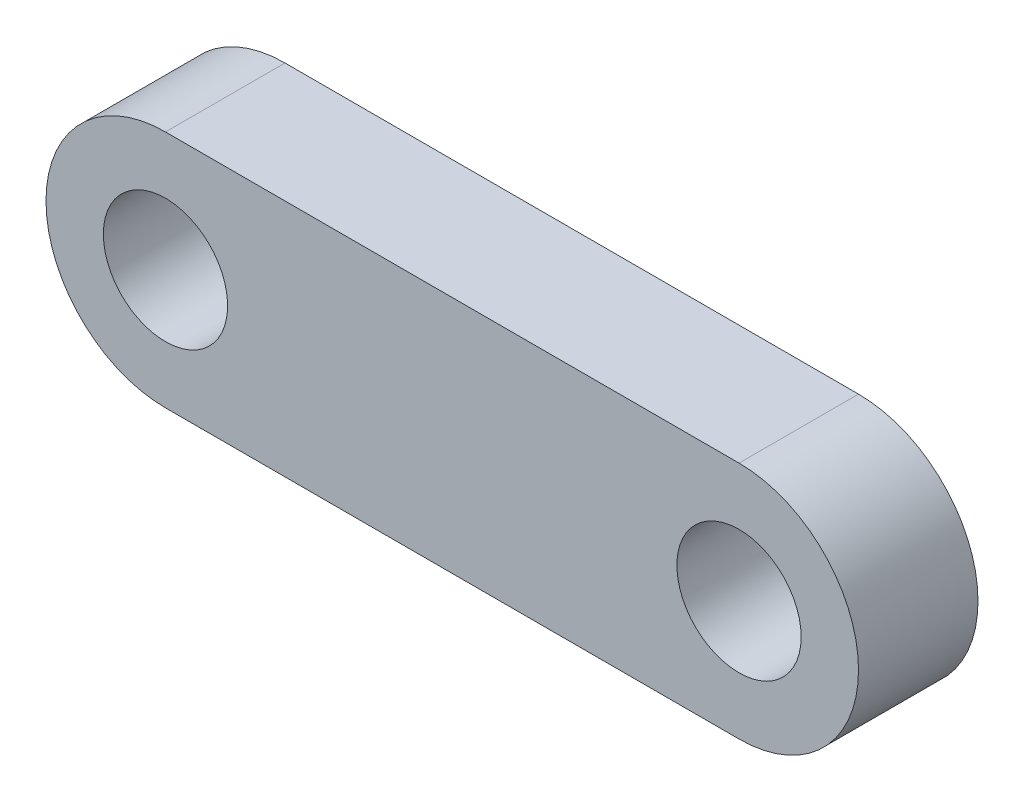
from build123d import *

# Parameters (mm, degrees)
SKETCH1_R           = 1.651
BOSS_EXTRUDE1_DEPTH = 3.175


with BuildPart() as part:
    # Sketch1 → Boss-Extrude1 (new body)
    with BuildSketch(Plane.XY):
        with BuildLine():
            Line((-71.178896696, 3.175), (-55.938896696, 3.175))
            ThreePointArc((-55.938896696, 3.175), (-52.763896696, 0), (-55.938896696, -3.175))
            Line((-55.938896696, -3.175), (-71.178896696, -3.175))
            ThreePointArc((-71.178896696, -3.175), (-74.353896696, 0), (-71.178896696, 3.175))
        make_face()
        with Locations((-55.938896696, 0)):
            Circle(SKETCH1_R, mode=Mode.SUBTRACT)
        with Locations(Location((-71.178896696, 0, 0), (0, 0, 180))):
            Circle(SKETCH1_R, mode=Mode.SUBTRACT)
    extrude(amount=BOSS_EXTRUDE1_DEPTH)


solid = part.part
